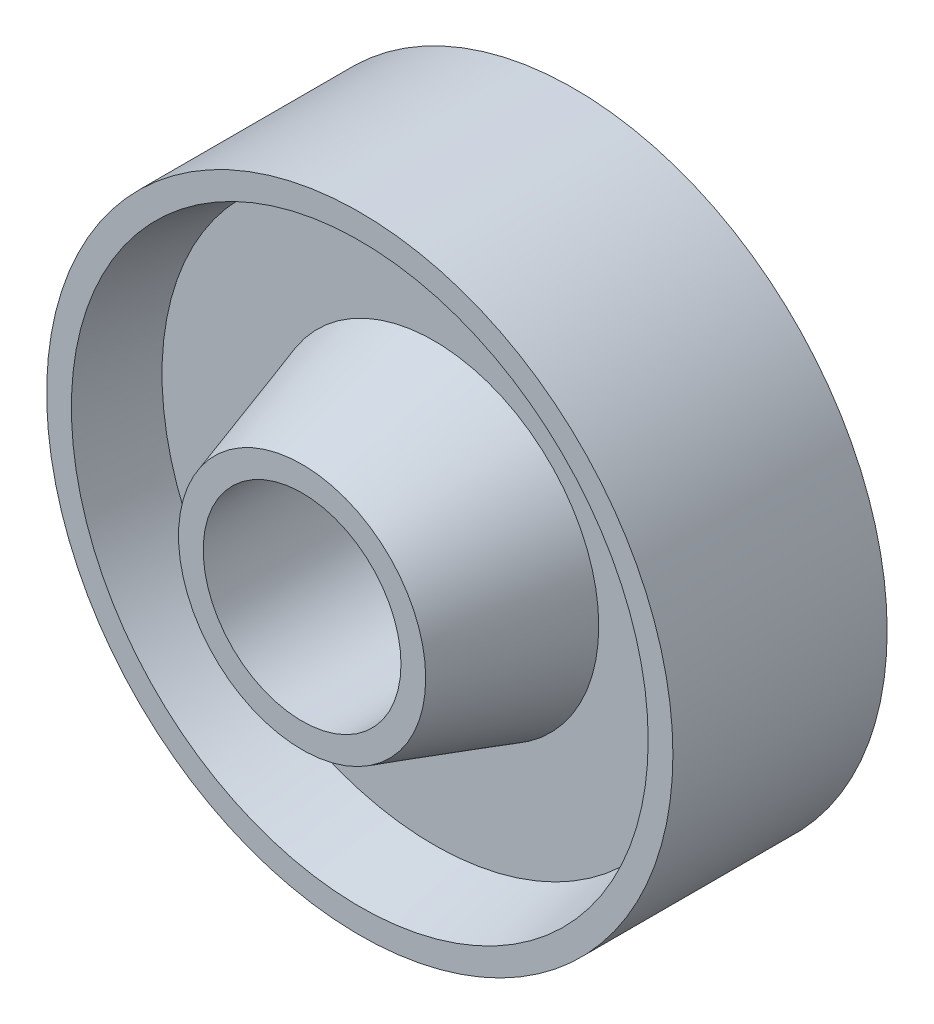
from build123d import *


with BuildPart() as part:
    # Sketch1 → Revolve1 (revolve)
    with BuildSketch(Plane(origin=(0, 0, 0), x_dir=(0, 0, -1), z_dir=(1, 0, 0)), mode=Mode.PRIVATE) as revolve1_sk:
        Polygon((13, 38), (13, 35), (4, 33), (4, 20), (20, 15), (20, 12), (-20, 12), (-20, 15), (-4, 20), (-4, 33), (-13, 35), (-13, 38), align=None)
    revolve(revolve1_sk.sketch.rotate(Axis((0, 0, 0), (0, 0, -1)), 90), axis=Axis((0, 0, 0), (0, 0, -1)))


solid = part.part
